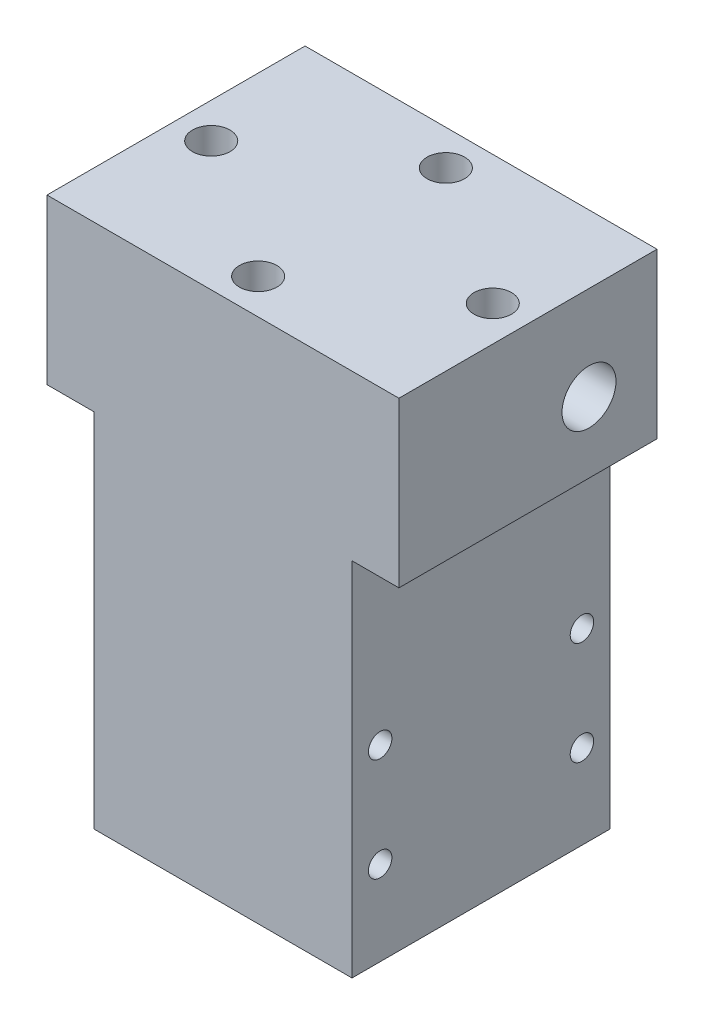
from build123d import *

# Parameters (mm, degrees)
SALIENTE_EXTRUIR1_DEPTH      = 27.5
SALIENTE_EXTRUIR1_DEPTH_BACK = 27.5
CROQUIS2_R                   = 4
CORTAR_EXTRUIR1_DEPTH        = 30
CROQUIS3_R                   = 2.5
CORTAR_EXTRUIR2_DEPTH        = 22
CORTAR_EXTRUIR3_START        = -22
CROQUIS4_R                   = 2.5
CORTAR_EXTRUIR3_DEPTH        = 22
CROQUIS5_R                   = 11
CORTAR_EXTRUIR4_DEPTH        = 2
CROQUIS6_R                   = 5.75
CORTAR_EXTRUIR5_DEPTH        = 20
CORTAR_EXTRUIR6_START        = -20
CROQUIS7_R                   = 5.75
CORTAR_EXTRUIR6_DEPTH        = 20
CROQUIS8_R                   = 3
CORTAR_EXTRUIR7_DEPTH        = 30


with BuildPart() as part:
    # Croquis1 → Saliente-Extruir1 (new, two sides: drawn at the far end of the back side and taken through both)
    with BuildSketch(Plane.XY.offset(-SALIENTE_EXTRUIR1_DEPTH_BACK)):
        Polygon((37.5, 0), (-37.5, 0), (-37.5, -35), (-27.5, -35), (-27.5, -112), (27.5, -112), (27.5, -35), (37.5, -35), align=None)
    extrude(amount=SALIENTE_EXTRUIR1_DEPTH + SALIENTE_EXTRUIR1_DEPTH_BACK)

    # Croquis2 → Cortar-Extruir1 (cut)
    with BuildSketch(Plane(origin=(0, 0, 0), x_dir=(1, 0, 0), z_dir=(0, 1, 0))):
        with Locations((-30, 0)):
            Circle(CROQUIS2_R)
        with Locations((0, 20)):
            Circle(CROQUIS2_R)
        with Locations((30, 0)):
            Circle(CROQUIS2_R)
        with Locations((0, -20)):
            Circle(CROQUIS2_R)
    extrude(amount=-CORTAR_EXTRUIR1_DEPTH, mode=Mode.SUBTRACT)

    # Croquis3 → Cortar-Extruir2 (cut)
    with BuildSketch(Plane(origin=(27.5, 0, 0), x_dir=(0, 0, -1), z_dir=(1, 0, 0))):
        with Locations((-21.5, -94)):
            Circle(CROQUIS3_R)
        with Locations((-21.5, -72)):
            Circle(CROQUIS3_R)
        with Locations((21.5, -72)):
            Circle(CROQUIS3_R)
        with Locations((21.5, -94)):
            Circle(CROQUIS3_R)
    extrude(amount=-CORTAR_EXTRUIR2_DEPTH, mode=Mode.SUBTRACT)

    # Croquis4 → Cortar-Extruir3 (cut)
    with BuildSketch(Plane.ZY.offset(27.5).offset(CORTAR_EXTRUIR3_START)):
        with Locations((-21.5, -94)):
            Circle(CROQUIS4_R)
        with Locations((-21.5, -72)):
            Circle(CROQUIS4_R)
        with Locations((21.5, -72)):
            Circle(CROQUIS4_R)
        with Locations((21.5, -94)):
            Circle(CROQUIS4_R)
    extrude(amount=CORTAR_EXTRUIR3_DEPTH, mode=Mode.SUBTRACT)

    # Croquis5 → Cortar-Extruir4 (cut)
    with BuildSketch(Plane.XZ.offset(112)):
        Circle(CROQUIS5_R)
    extrude(amount=-CORTAR_EXTRUIR4_DEPTH, mode=Mode.SUBTRACT)

    # Croquis6 → Cortar-Extruir5 (cut)
    with BuildSketch(Plane(origin=(37.5, 0, 0), x_dir=(0, 0, -1), z_dir=(1, 0, 0))):
        with Locations((13, -20)):
            Circle(CROQUIS6_R)
    extrude(amount=-CORTAR_EXTRUIR5_DEPTH, mode=Mode.SUBTRACT)

    # Croquis7 → Cortar-Extruir6 (cut)
    with BuildSketch(Plane.ZY.offset(37.5).offset(CORTAR_EXTRUIR6_START)):
        with Locations((-13, -20)):
            Circle(CROQUIS7_R)
    extrude(amount=CORTAR_EXTRUIR6_DEPTH, mode=Mode.SUBTRACT)

    # Croquis8 → Cortar-Extruir7 (cut)
    with BuildSketch(Plane.XZ.offset(110)):
        Circle(CROQUIS8_R)
    extrude(amount=-CORTAR_EXTRUIR7_DEPTH, mode=Mode.SUBTRACT)


solid = part.part
